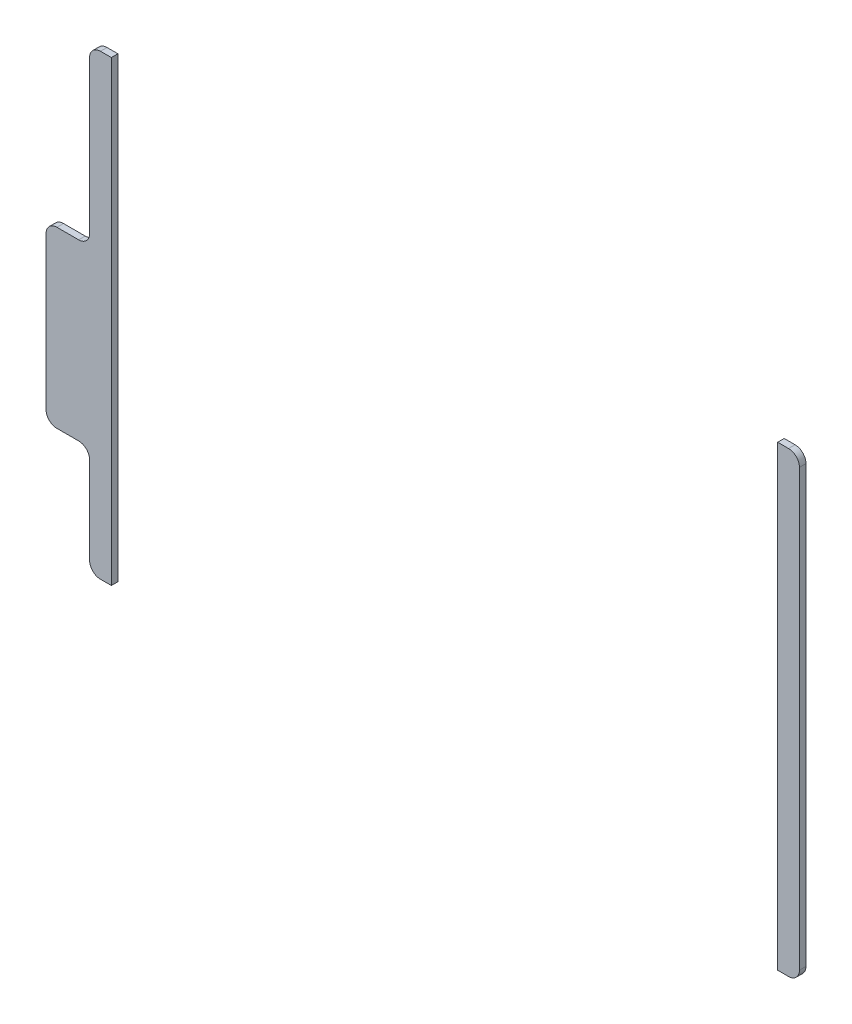
from build123d import *

# Parameters (mm, degrees)
EXTRUDE_1_DEPTH   = 0.6
EXTRUDE_1_2_DEPTH = 0.6


with BuildPart() as part:
    # Эскиз1 → Бобышка-Вытянуть1 (new body)
    with BuildSketch(Plane.XY):
        with BuildLine():
            Line((-30.6, -21), (-31.6, -21))
            ThreePointArc((-31.6, -21), (-32.307106781, -20.707106781), (-32.6, -20))
            Line((-32.6, -20), (-32.6, -12))
            ThreePointArc((-32.6, -12), (-32.892893219, -11.292893219), (-33.6, -11))
            Line((-33.6, -11), (-35.6, -11))
            ThreePointArc((-35.6, -11), (-36.307106781, -10.707106781), (-36.6, -10))
            Line((-36.6, -10), (-36.6, 4))
            ThreePointArc((-36.6, 4), (-36.307106781, 4.707106781), (-35.6, 5))
            Line((-35.6, 5), (-33.6, 5))
            ThreePointArc((-33.6, 5), (-32.892893219, 5.292893219), (-32.6, 6))
            Line((-32.6, 6), (-32.6, 20))
            ThreePointArc((-32.6, 20), (-32.307106781, 20.707106781), (-31.6, 21))
            Line((-31.6, 21), (-30.6, 21))
            Line((-30.6, 21), (-30.6, -21))
        make_face()
    extrude(amount=EXTRUDE_1_DEPTH)


with BuildPart() as body_2:
    # Эскиз1 → Extrude 1 2 (new body)
    with BuildSketch(Plane.XY):
        with BuildLine():
            Line((30.6, 21), (31.6, 21))
            ThreePointArc((31.6, 21), (32.307106781, 20.707106781), (32.6, 20))
            Line((32.6, 20), (32.6, -20))
            ThreePointArc((32.6, -20), (32.307106781, -20.707106781), (31.6, -21))
            Line((31.6, -21), (30.6, -21))
            Line((30.6, -21), (30.6, 21))
        make_face()
    extrude(amount=EXTRUDE_1_2_DEPTH)


solid = Compound([part.part, body_2.part])
